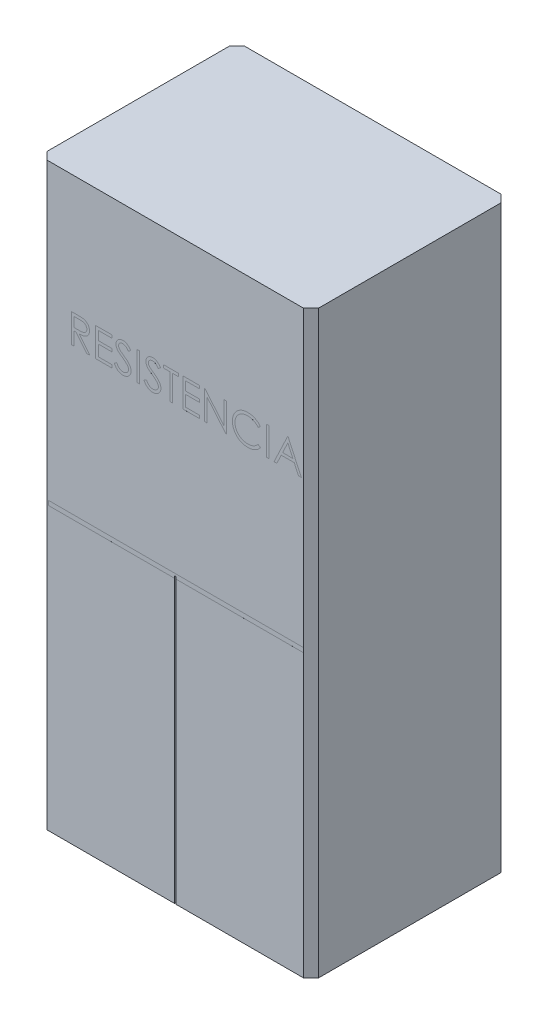
from build123d import *

# Parameters (mm, degrees)
SALIENTE_EXTRUIR1_DEPTH = 1150
CROQUIS2_W              = 6.269589385
CROQUIS2_H              = 1150
CORTAR_EXTRUIR1_DEPTH   = 51
SALIENTE_EXTRUIR2_DEPTH = 1200
CROQUIS4_W              = 1033.704287534
CROQUIS4_H              = 18.129714048
CORTAR_EXTRUIR2_DEPTH   = 0.01
CROQUIS6_W              = 10.447649573
CROQUIS6_H              = 116.416666667
CORTAR_EXTRUIR4_DEPTH   = 0.01


with BuildPart() as part:
    # Croquis1 → Saliente-Extruir1 (new body)
    with BuildSketch(Plane(origin=(0, 0, 0), x_dir=(1, 0, 0), z_dir=(0, 1, 0))):
        Polygon((-550, 370), (-520, 400), (520, 400), (550, 370), (550, -370), (520, -400), (-520, -400), (-550, -370), align=None)
    extrude(amount=SALIENTE_EXTRUIR1_DEPTH)

    # Croquis2 → Cortar-Extruir1 (cut)
    with BuildSketch(Plane.XY.offset(400)):
        with Locations((0.013061541, 575)):
            Rectangle(CROQUIS2_W, CROQUIS2_H)
    extrude(amount=-CORTAR_EXTRUIR1_DEPTH, mode=Mode.SUBTRACT)

    # Croquis3 → Saliente-Extruir2 (add)
    with BuildSketch(Plane(origin=(0, 1150, 0), x_dir=(1, 0, 0), z_dir=(0, 1, 0))):
        Polygon((-550, 370), (-520, 400), (520, 400), (550, 370), (550, -370), (520, -400), (-520, -400), (-550, -370), align=None)
    extrude(amount=SALIENTE_EXTRUIR2_DEPTH)

    # Croquis4 → Cortar-Extruir2 (cut)
    with BuildSketch(Plane.XY.offset(400)):
        with Locations((3.147856233, 1150)):
            Rectangle(CROQUIS4_W, CROQUIS4_H)
    extrude(amount=-CORTAR_EXTRUIR2_DEPTH, mode=Mode.SUBTRACT)

    # Croquis6 → Cortar-Extruir4 (cut)
    # profile 1 of 11: a face of its own
    with BuildSketch(Plane.XY.offset(400)):
        with BuildLine():
            Line((-420.727042954, 1868.160847318), (-397.429717233, 1868.160847318))
            add(Edge.make_bspline(
                [(-397.429717233, 1868.160847318), (-395.875018268, 1868.155672231), (-392.889824036, 1868.145735492), (-388.613232162, 1868.090329045), (-384.727340388, 1867.93152488), (-381.234180495, 1867.794865568), (-378.133816566, 1867.545669329), (-375.416741681, 1867.307492567), (-373.095469933, 1866.995706755), (-371.69029245, 1866.706147805), (-371.054066191, 1866.575043365)],
                knots=[0, 0, 0, 0, 1.410062039, 2.707475311, 3.878576406, 4.937260626, 5.877586885, 6.699081471, 7.410979367, 8, 8, 8, 8], degree=3))
            add(Edge.make_bspline(
                [(-371.054066191, 1866.575043365), (-370.202341098, 1866.364603098), (-368.517060519, 1865.948211826), (-366.09060237, 1865.068115103), (-363.778423547, 1864.049648065), (-361.590128677, 1862.853426225), (-359.53667867, 1861.470569863), (-357.59690057, 1859.9249516), (-355.761992181, 1858.225028589), (-354.106160339, 1856.327941123), (-352.544878072, 1854.337664837), (-351.228084948, 1852.185494639), (-350.092973229, 1849.934943354), (-349.18923008, 1847.563122816), (-348.46152701, 1845.093034833), (-347.948420906, 1842.502305094), (-347.640708784, 1839.80273647), (-347.609380874, 1837.96142698), (-347.593495945, 1837.027784417)],
                knots=[0, 0, 0, 0, 1.027469482, 2.033020251, 3.019912614, 3.986113645, 4.951240523, 5.91722682, 6.890402269, 7.87763091, 8.8651537, 9.85103654, 10.82876324, 11.815024772, 12.821070561, 13.842952187, 14.906261191, 16, 16, 16, 16], degree=3))
            add(Edge.make_bspline(
                [(-347.593495945, 1837.027784417), (-347.64235762, 1835.476612009), (-347.737699404, 1832.449872877), (-348.626627258, 1828.057276417), (-350.082717688, 1823.959765166), (-352.089185182, 1820.162498376), (-354.644347267, 1816.739494291), (-357.715245675, 1813.732935575), (-361.303593562, 1811.217008006), (-364.644063904, 1809.472327812), (-367.594867166, 1808.354963685), (-370.02409426, 1807.568773367), (-372.673969678, 1806.961345617), (-375.519104356, 1806.417176473), (-378.571338325, 1806.006335589), (-381.823356064, 1805.705428626), (-385.277476869, 1805.517364196), (-387.6503502, 1805.48935751), (-388.871040016, 1805.474949882)],
                knots=[0, 0, 0, 0, 1.260483769, 2.459530307, 3.627416485, 4.787058657, 5.939039949, 7.08810263, 8.267026773, 9.491475466, 10.141966685, 10.831826277, 11.566392101, 12.351337768, 13.187381173, 14.07005841, 15.007169909, 16, 16, 16, 16], degree=3))
            Line((-388.871040016, 1805.474949882), (-346.100974578, 1751.744180651))
            Line((-346.100974578, 1751.744180651), (-359.020612665, 1751.744180651))
            Line((-359.020612665, 1751.744180651), (-401.790678103, 1805.474949882))
            Line((-401.790678103, 1805.474949882), (-410.279393381, 1805.474949882))
            Line((-410.279393381, 1805.474949882), (-410.279393381, 1751.744180651))
            Line((-410.279393381, 1751.744180651), (-420.727042954, 1751.744180651))
            Line((-420.727042954, 1751.744180651), (-420.727042954, 1868.160847318))
        make_face()
        with BuildLine():
            Line((-410.279393381, 1856.220676377), (-410.279393381, 1817.415120822))
            Line((-410.279393381, 1817.415120822), (-388.964322601, 1817.251876297))
            add(Edge.make_bspline(
                [(-388.964322601, 1817.251876297), (-387.969125116, 1817.251436021), (-386.040148942, 1817.25058264), (-383.24945302, 1817.383423245), (-380.651029305, 1817.534542664), (-378.254816668, 1817.765691133), (-376.05974465, 1818.063587138), (-374.066910406, 1818.436219733), (-372.273060894, 1818.870356198), (-370.180935699, 1819.542300751), (-367.844734882, 1820.606881883), (-365.305805134, 1822.155739065), (-363.143703566, 1824.103859529), (-361.31703086, 1826.331524245), (-359.849201913, 1828.780806141), (-358.814355725, 1831.422345851), (-358.15768449, 1834.18945686), (-358.080232633, 1836.091309638), (-358.041145518, 1837.051105063)],
                knots=[0, 0, 0, 0, 1.146690395, 2.22261258, 3.21895312, 4.145990853, 4.996080663, 5.770904154, 6.481378293, 7.121626537, 8.300444488, 9.431385265, 10.535395872, 11.636531494, 12.74115979, 13.810798291, 14.895190096, 16, 16, 16, 16], degree=3))
            add(Edge.make_bspline(
                [(-358.041145518, 1837.051105063), (-358.081130355, 1837.987313718), (-358.160365712, 1839.842537657), (-358.807268799, 1842.558568768), (-359.901232269, 1845.121962324), (-361.375474326, 1847.522290551), (-363.171589075, 1849.701136098), (-365.277660131, 1851.565371165), (-367.636101979, 1853.103716455), (-369.840408267, 1854.086751445), (-371.810651002, 1854.689452278), (-373.521299456, 1855.113580274), (-375.454197893, 1855.454330824), (-377.6187316, 1855.727346563), (-380.005660129, 1855.962007447), (-382.6270525, 1856.120060656), (-385.465516357, 1856.213655136), (-387.43285595, 1856.218281497), (-388.451268381, 1856.220676377)],
                knots=[0, 0, 0, 0, 1.101028733, 2.181837193, 3.264309656, 4.369019818, 5.486613113, 6.575447106, 7.666700264, 8.788928104, 9.402425223, 10.0903467, 10.862060571, 11.710948788, 12.657782767, 13.684531032, 14.801375019, 16, 16, 16, 16], degree=3))
            Line((-388.451268381, 1856.220676377), (-410.279393381, 1856.220676377))
        make_face(mode=Mode.SUBTRACT)
    # profile 2 of 11: a face of its own
    with BuildSketch(Plane.XY.offset(400)):
        Polygon((-322.220632697, 1868.160847318), (-256.549692526, 1868.160847318), (-256.549692526, 1856.220676377), (-311.772983125, 1856.220676377), (-311.772983125, 1820.400163557), (-256.549692526, 1820.400163557), (-256.549692526, 1808.459992617), (-311.772983125, 1808.459992617), (-311.772983125, 1763.684351591), (-256.549692526, 1763.684351591), (-256.549692526, 1751.744180651), (-322.220632697, 1751.744180651), align=None)
    # profile 3 of 11: a face of its own
    with BuildSketch(Plane.XY.offset(400)):
        with BuildLine():
            Line((-247.594564321, 1774.201963103), (-237.753251554, 1780.102086634))
            add(Edge.make_bspline(
                [(-237.753251554, 1780.102086634), (-236.837942568, 1778.569897449), (-235.084245871, 1775.634282098), (-232.15881614, 1771.667532516), (-229.127561928, 1768.296034111), (-225.968035762, 1765.539400284), (-222.699523154, 1763.369098027), (-219.300686891, 1761.832323796), (-215.782980663, 1760.873849568), (-213.388994267, 1760.757430022), (-212.193823135, 1760.699308856)],
                knots=[0, 0, 0, 0, 1.272034388, 2.437168799, 3.508375237, 4.49857839, 5.41946034, 6.295179144, 7.148887113, 8, 8, 8, 8], degree=3))
            add(Edge.make_bspline(
                [(-212.193823135, 1760.699308856), (-211.173119704, 1760.727736892), (-209.149572753, 1760.784095539), (-206.170561957, 1761.325626027), (-203.277381534, 1762.157577076), (-200.529660893, 1763.349049489), (-197.965313905, 1764.790570073), (-195.716586444, 1766.531703644), (-193.772557393, 1768.481057677), (-192.182335178, 1770.655809309), (-190.962287337, 1772.994691609), (-190.024565443, 1775.395401229), (-189.504180493, 1777.895650988), (-189.425790384, 1779.579051383), (-189.386230988, 1780.428575683)],
                knots=[0, 0, 0, 0, 1.095163259, 2.171163733, 3.241058638, 4.321873601, 5.38011039, 6.391990106, 7.366004449, 8.327778327, 9.272591725, 10.192022065, 11.087607919, 12, 12, 12, 12], degree=3))
            add(Edge.make_bspline(
                [(-189.386230988, 1780.428575683), (-189.43526937, 1781.397855851), (-189.534957235, 1783.368260792), (-190.377530513, 1786.275339725), (-191.702992366, 1789.152247352), (-192.92578792, 1790.931801352), (-193.560626688, 1791.855692403)],
                knots=[0, 0, 0, 0, 0.938893495, 1.908633276, 2.914225137, 4, 4, 4, 4], degree=3))
            add(Edge.make_bspline(
                [(-193.560626688, 1791.855692403), (-194.081861164, 1792.522487941), (-195.176127748, 1793.922341764), (-197.057338346, 1796.006041621), (-199.264801719, 1798.155373318), (-201.722974724, 1800.452409093), (-204.521401512, 1802.790315092), (-207.572433361, 1805.280576623), (-210.953966955, 1807.828490983), (-213.325524021, 1809.537240366), (-214.549208419, 1810.418926912)],
                knots=[0, 0, 0, 0, 0.722233717, 1.516239348, 2.393582979, 3.351407094, 4.387010283, 5.505090956, 6.712668013, 8, 8, 8, 8], degree=3))
            add(Edge.make_bspline(
                [(-214.549208419, 1810.418926912), (-215.774044672, 1811.291339695), (-218.11583832, 1812.959326504), (-221.390758309, 1815.43481995), (-224.319284852, 1817.698088659), (-226.888401664, 1819.770438776), (-229.09697873, 1821.652151366), (-230.962419806, 1823.325156628), (-232.437204669, 1824.834700307), (-233.257296245, 1825.813975412), (-233.625497147, 1826.253645795)],
                knots=[0, 0, 0, 0, 1.452282411, 2.77665338, 3.964542531, 5.026858415, 5.96415736, 6.766646006, 7.446254459, 8, 8, 8, 8], degree=3))
            add(Edge.make_bspline(
                [(-233.625497147, 1826.253645795), (-234.140143473, 1826.938875521), (-235.152264542, 1828.286471739), (-236.48826239, 1830.392777127), (-237.623795972, 1832.548922408), (-238.513962115, 1834.760701522), (-239.26355968, 1836.997063323), (-239.767741327, 1839.2871869), (-240.083443268, 1841.620796186), (-240.115773391, 1843.191207147), (-240.131957484, 1843.977337035)],
                knots=[0, 0, 0, 0, 1.068054152, 2.10047183, 3.106115577, 4.101338837, 5.06977816, 6.043150881, 7.020423561, 8, 8, 8, 8], degree=3))
            add(Edge.make_bspline(
                [(-240.131957484, 1843.977337035), (-240.088543747, 1845.209017869), (-240.00264421, 1847.646053227), (-239.276187005, 1851.206102516), (-238.129552899, 1854.605017394), (-236.523172939, 1857.80914778), (-234.452374795, 1860.735063858), (-232.055988457, 1863.416421985), (-229.201734975, 1865.670534113), (-226.070039387, 1867.640039959), (-222.642188153, 1869.18159371), (-219.050205009, 1870.344462502), (-215.288380971, 1871.003356145), (-212.740414802, 1871.097911921), (-211.447562452, 1871.145890053)],
                knots=[0, 0, 0, 0, 1.005424448, 1.989358655, 2.955360095, 3.929531133, 4.905563448, 5.876582895, 6.856512386, 7.866279853, 8.892233794, 9.918561126, 10.94386622, 12, 12, 12, 12], degree=3))
            add(Edge.make_bspline(
                [(-211.447562452, 1871.145890053), (-210.075705116, 1871.098573277), (-207.347518725, 1871.004475312), (-203.334496007, 1870.186314568), (-199.470769321, 1868.832532699), (-196.362668346, 1867.296209956), (-193.9301334, 1865.7617912), (-192.075026077, 1864.364131807), (-190.195148011, 1862.755083552), (-188.275335568, 1860.930360533), (-186.348118872, 1858.873219789), (-184.384886425, 1856.597749969), (-182.381047293, 1854.117856909), (-181.091953565, 1852.347508634), (-180.431102783, 1851.439943872)],
                knots=[0, 0, 0, 0, 1.286793592, 2.559021753, 3.825965368, 5.121522368, 5.803751409, 6.523245864, 7.299691795, 8.125521123, 9.008227632, 9.944561021, 10.946284179, 12, 12, 12, 12], degree=3))
            Line((-180.431102783, 1851.439943872), (-189.875964562, 1844.280505437))
            add(Edge.make_bspline(
                [(-189.875964562, 1844.280505437), (-190.446270935, 1845.015217354), (-191.544547666, 1846.430100725), (-193.211949884, 1848.411556151), (-194.783529911, 1850.221551911), (-196.331884876, 1851.793680098), (-197.775239713, 1853.21403439), (-199.176132761, 1854.43008154), (-200.51440392, 1855.453736464), (-202.201344971, 1856.546175827), (-204.32071765, 1857.629067148), (-206.981155677, 1858.545401959), (-209.761394396, 1859.096054852), (-211.654982377, 1859.168861422), (-212.61359477, 1859.205719113)],
                knots=[0, 0, 0, 0, 1.181633172, 2.275549214, 3.290209073, 4.226197932, 5.078386478, 5.862611352, 6.581680152, 7.217281963, 8.414376989, 9.595101626, 10.782541182, 12, 12, 12, 12], degree=3))
            add(Edge.make_bspline(
                [(-212.61359477, 1859.205719113), (-213.816229575, 1859.165415664), (-216.135397504, 1859.087694261), (-219.42800131, 1858.23885094), (-222.39143496, 1856.90232573), (-224.937719089, 1855.029182292), (-227.057732349, 1852.809914987), (-228.591287727, 1850.256104022), (-229.514311058, 1847.436079821), (-229.626945169, 1845.468915681), (-229.684307911, 1844.467070608)],
                knots=[0, 0, 0, 0, 1.14458467, 2.207223713, 3.21896685, 4.227309161, 5.202851033, 6.127160689, 7.046193047, 8, 8, 8, 8], degree=3))
            add(Edge.make_bspline(
                [(-229.684307911, 1844.467070608), (-229.67123177, 1843.843360715), (-229.645058107, 1842.59492104), (-229.280015432, 1840.750501124), (-228.811044895, 1838.91074062), (-228.067886405, 1837.0839109), (-227.041912854, 1835.238062815), (-225.69463355, 1833.341411211), (-223.997833623, 1831.377238901), (-222.69805776, 1830.099736492), (-222.011815256, 1829.425253701)],
                knots=[0, 0, 0, 0, 0.858281714, 1.717966888, 2.583508476, 3.4729293, 4.427298488, 5.488583878, 6.674047936, 8, 8, 8, 8], degree=3))
            add(Edge.make_bspline(
                [(-222.011815256, 1829.425253701), (-221.756983417, 1829.1978412), (-221.151561298, 1828.657561151), (-220.044740625, 1827.773051245), (-218.583119455, 1826.681968557), (-216.804864812, 1825.331957102), (-214.677188518, 1823.765937993), (-212.199856615, 1822.00393475), (-209.400483725, 1819.988746983), (-207.414019046, 1818.579854501), (-206.363661544, 1817.834892457)],
                knots=[0, 0, 0, 0, 0.420754252, 0.999615792, 1.744751191, 2.668019286, 3.750313428, 4.999500688, 6.413464383, 8, 8, 8, 8], degree=3))
            add(Edge.make_bspline(
                [(-206.363661544, 1817.834892457), (-205.100177713, 1816.915488188), (-202.65361639, 1815.135189248), (-199.172505934, 1812.460410558), (-196.016157127, 1809.844435969), (-193.173488189, 1807.303971276), (-190.616415782, 1804.858286849), (-188.37330874, 1802.477959161), (-186.421311229, 1800.180041422), (-184.319850082, 1797.233948845), (-182.172534037, 1793.61568278), (-180.328443898, 1789.182594702), (-179.165662674, 1784.732274233), (-179.013605363, 1781.741136362), (-178.938581415, 1780.265331158)],
                knots=[0, 0, 0, 0, 1.163667725, 2.253281268, 3.268753668, 4.215851969, 5.092017293, 5.902905408, 6.650798638, 7.335211899, 8.59617414, 9.77448103, 10.901945474, 12, 12, 12, 12], degree=3))
            add(Edge.make_bspline(
                [(-178.938581415, 1780.265331158), (-178.960439081, 1779.221626967), (-179.003729951, 1777.154486614), (-179.501358441, 1774.119168938), (-180.230448256, 1771.171137392), (-181.329329585, 1768.346832056), (-182.670554635, 1765.59458364), (-184.372441498, 1762.986587524), (-186.34512806, 1760.465122314), (-188.608060668, 1758.097423804), (-191.084273181, 1755.923884857), (-193.701442739, 1753.99040155), (-196.463853008, 1752.378252793), (-199.356518351, 1751.062716452), (-202.380103217, 1750.033808738), (-205.533590694, 1749.28831402), (-208.82217896, 1748.830772873), (-211.057394978, 1748.783282807), (-212.193823135, 1748.759137916)],
                knots=[0, 0, 0, 0, 0.983748083, 1.948392443, 2.894712957, 3.844097841, 4.80183111, 5.778335162, 6.776009319, 7.81870978, 8.863265674, 9.881300176, 10.883814829, 11.87499822, 12.874611388, 13.892143829, 14.928324115, 16, 16, 16, 16], degree=3))
            add(Edge.make_bspline(
                [(-212.193823135, 1748.759137916), (-213.073112996, 1748.77614079), (-214.820618967, 1748.809932403), (-217.405384353, 1749.108666897), (-219.937932117, 1749.531329367), (-222.386483355, 1750.202357361), (-224.782584881, 1751.01650824), (-227.115815515, 1752.018966589), (-229.387306044, 1753.220293503), (-231.609786122, 1754.59384468), (-233.77760331, 1756.192336802), (-235.87042466, 1758.05412191), (-237.956916854, 1760.12785216), (-239.975495251, 1762.469841612), (-241.966990075, 1765.042253559), (-243.89213622, 1767.869155683), (-245.790782877, 1770.935150045), (-246.982073557, 1773.092686348), (-247.594564321, 1774.201963103)],
                knots=[0, 0, 0, 0, 0.915332311, 1.819136955, 2.706846663, 3.586547465, 4.459518054, 5.340707479, 6.227863349, 7.133153174, 8.059268498, 9.028702269, 10.047606654, 11.120612155, 12.245963614, 13.433783089, 14.680604001, 16, 16, 16, 16], degree=3))
        make_face()
    # profile 4 of 11: a face of its own
    with BuildSketch(Plane.XY.offset(400)):
        with Locations((-149.834414749, 1809.952513985)):
            Rectangle(CROQUIS6_W, CROQUIS6_H)
    # profile 5 of 11: a face of its own
    with BuildSketch(Plane.XY.offset(400)):
        with BuildLine():
            Line((-126.700333552, 1774.201963103), (-116.859020785, 1780.102086634))
            add(Edge.make_bspline(
                [(-116.859020785, 1780.102086634), (-115.943711798, 1778.569897449), (-114.190015102, 1775.634282098), (-111.26458537, 1771.667532516), (-108.233331159, 1768.296034111), (-105.073804993, 1765.539400284), (-101.805292385, 1763.369098027), (-98.406456121, 1761.832323796), (-94.888749894, 1760.873849568), (-92.494763498, 1760.757430022), (-91.299592366, 1760.699308856)],
                knots=[0, 0, 0, 0, 1.272034388, 2.437168799, 3.508375237, 4.49857839, 5.41946034, 6.295179144, 7.148887113, 8, 8, 8, 8], degree=3))
            add(Edge.make_bspline(
                [(-91.299592366, 1760.699308856), (-90.278888934, 1760.727736892), (-88.255341983, 1760.784095539), (-85.276331188, 1761.325626027), (-82.383150765, 1762.157577076), (-79.635430124, 1763.349049489), (-77.071083136, 1764.790570073), (-74.822355674, 1766.531703644), (-72.878326624, 1768.481057677), (-71.288104409, 1770.655809309), (-70.068056568, 1772.994691609), (-69.130334674, 1775.395401229), (-68.609949724, 1777.895650988), (-68.531559615, 1779.579051383), (-68.492000219, 1780.428575683)],
                knots=[0, 0, 0, 0, 1.095163259, 2.171163733, 3.241058638, 4.321873601, 5.38011039, 6.391990106, 7.366004449, 8.327778327, 9.272591725, 10.192022065, 11.087607919, 12, 12, 12, 12], degree=3))
            add(Edge.make_bspline(
                [(-68.492000219, 1780.428575683), (-68.541038601, 1781.397855851), (-68.640726466, 1783.368260792), (-69.483299743, 1786.275339725), (-70.808761597, 1789.152247352), (-72.03155715, 1790.931801352), (-72.666395919, 1791.855692403)],
                knots=[0, 0, 0, 0, 0.938893495, 1.908633276, 2.914225137, 4, 4, 4, 4], degree=3))
            add(Edge.make_bspline(
                [(-72.666395919, 1791.855692403), (-73.187630395, 1792.522487941), (-74.281896979, 1793.922341764), (-76.163107576, 1796.006041621), (-78.37057095, 1798.155373318), (-80.828743955, 1800.452409093), (-83.627170743, 1802.790315092), (-86.678202591, 1805.280576623), (-90.059736186, 1807.828490983), (-92.431293252, 1809.537240366), (-93.654977649, 1810.418926912)],
                knots=[0, 0, 0, 0, 0.722233717, 1.516239348, 2.393582979, 3.351407094, 4.387010283, 5.505090956, 6.712668013, 8, 8, 8, 8], degree=3))
            add(Edge.make_bspline(
                [(-93.654977649, 1810.418926912), (-94.879813903, 1811.291339695), (-97.22160755, 1812.959326504), (-100.496527539, 1815.43481995), (-103.425054083, 1817.698088659), (-105.994170894, 1819.770438776), (-108.202747961, 1821.652151366), (-110.068189037, 1823.325156628), (-111.5429739, 1824.834700307), (-112.363065476, 1825.813975412), (-112.731266378, 1826.253645795)],
                knots=[0, 0, 0, 0, 1.452282411, 2.77665338, 3.964542531, 5.026858415, 5.96415736, 6.766646006, 7.446254459, 8, 8, 8, 8], degree=3))
            add(Edge.make_bspline(
                [(-112.731266378, 1826.253645795), (-113.245912704, 1826.938875521), (-114.258033773, 1828.286471739), (-115.594031621, 1830.392777127), (-116.729565203, 1832.548922408), (-117.619731346, 1834.760701522), (-118.36932891, 1836.997063323), (-118.873510558, 1839.2871869), (-119.189212498, 1841.620796186), (-119.221542622, 1843.191207147), (-119.237726715, 1843.977337035)],
                knots=[0, 0, 0, 0, 1.068054152, 2.10047183, 3.106115577, 4.101338837, 5.06977816, 6.043150881, 7.020423561, 8, 8, 8, 8], degree=3))
            add(Edge.make_bspline(
                [(-119.237726715, 1843.977337035), (-119.194312977, 1845.209017869), (-119.108413441, 1847.646053227), (-118.381956236, 1851.206102516), (-117.23532213, 1854.605017394), (-115.628942169, 1857.80914778), (-113.558144026, 1860.735063858), (-111.161757688, 1863.416421985), (-108.307504205, 1865.670534113), (-105.175808617, 1867.640039959), (-101.747957384, 1869.18159371), (-98.15597424, 1870.344462502), (-94.394150201, 1871.003356145), (-91.846184033, 1871.097911921), (-90.553331682, 1871.145890053)],
                knots=[0, 0, 0, 0, 1.005424448, 1.989358655, 2.955360095, 3.929531133, 4.905563448, 5.876582895, 6.856512386, 7.866279853, 8.892233794, 9.918561126, 10.94386622, 12, 12, 12, 12], degree=3))
            add(Edge.make_bspline(
                [(-90.553331682, 1871.145890053), (-89.181474346, 1871.098573277), (-86.453287956, 1871.004475312), (-82.440265238, 1870.186314568), (-78.576538552, 1868.832532699), (-75.468437577, 1867.296209956), (-73.03590263, 1865.7617912), (-71.180795307, 1864.364131807), (-69.300917242, 1862.755083552), (-67.381104799, 1860.930360533), (-65.453888103, 1858.873219789), (-63.490655656, 1856.597749969), (-61.486816524, 1854.117856909), (-60.197722796, 1852.347508634), (-59.536872014, 1851.439943872)],
                knots=[0, 0, 0, 0, 1.286793592, 2.559021753, 3.825965368, 5.121522368, 5.803751409, 6.523245864, 7.299691795, 8.125521123, 9.008227632, 9.944561021, 10.946284179, 12, 12, 12, 12], degree=3))
            Line((-59.536872014, 1851.439943872), (-68.981733793, 1844.280505437))
            add(Edge.make_bspline(
                [(-68.981733793, 1844.280505437), (-69.552040165, 1845.015217354), (-70.650316897, 1846.430100725), (-72.317719115, 1848.411556151), (-73.889299142, 1850.221551911), (-75.437654106, 1851.793680098), (-76.881008943, 1853.21403439), (-78.281901992, 1854.43008154), (-79.620173151, 1855.453736464), (-81.307114202, 1856.546175827), (-83.426486881, 1857.629067148), (-86.086924908, 1858.545401959), (-88.867163627, 1859.096054852), (-90.760751608, 1859.168861422), (-91.719364001, 1859.205719113)],
                knots=[0, 0, 0, 0, 1.181633172, 2.275549214, 3.290209073, 4.226197932, 5.078386478, 5.862611352, 6.581680152, 7.217281963, 8.414376989, 9.595101626, 10.782541182, 12, 12, 12, 12], degree=3))
            add(Edge.make_bspline(
                [(-91.719364001, 1859.205719113), (-92.921998806, 1859.165415664), (-95.241166735, 1859.087694261), (-98.533770541, 1858.23885094), (-101.497204191, 1856.90232573), (-104.043488319, 1855.029182292), (-106.16350158, 1852.809914987), (-107.697056958, 1850.256104022), (-108.620080288, 1847.436079821), (-108.7327144, 1845.468915681), (-108.790077142, 1844.467070608)],
                knots=[0, 0, 0, 0, 1.14458467, 2.207223713, 3.21896685, 4.227309161, 5.202851033, 6.127160689, 7.046193047, 8, 8, 8, 8], degree=3))
            add(Edge.make_bspline(
                [(-108.790077142, 1844.467070608), (-108.777001001, 1843.843360715), (-108.750827338, 1842.59492104), (-108.385784662, 1840.750501124), (-107.916814125, 1838.91074062), (-107.173655636, 1837.0839109), (-106.147682085, 1835.238062815), (-104.800402781, 1833.341411211), (-103.103602854, 1831.377238901), (-101.803826991, 1830.099736492), (-101.117584487, 1829.425253701)],
                knots=[0, 0, 0, 0, 0.858281714, 1.717966888, 2.583508476, 3.4729293, 4.427298488, 5.488583878, 6.674047936, 8, 8, 8, 8], degree=3))
            add(Edge.make_bspline(
                [(-101.117584487, 1829.425253701), (-100.862752648, 1829.1978412), (-100.257330529, 1828.657561151), (-99.150509856, 1827.773051245), (-97.688888686, 1826.681968557), (-95.910634042, 1825.331957102), (-93.782957749, 1823.765937993), (-91.305625846, 1822.00393475), (-88.506252956, 1819.988746983), (-86.519788277, 1818.579854501), (-85.469430774, 1817.834892457)],
                knots=[0, 0, 0, 0, 0.420754252, 0.999615792, 1.744751191, 2.668019286, 3.750313428, 4.999500688, 6.413464383, 8, 8, 8, 8], degree=3))
            add(Edge.make_bspline(
                [(-85.469430774, 1817.834892457), (-84.205946944, 1816.915488188), (-81.759385621, 1815.135189248), (-78.278275165, 1812.460410558), (-75.121926358, 1809.844435969), (-72.27925742, 1807.303971276), (-69.722185013, 1804.858286849), (-67.479077971, 1802.477959161), (-65.52708046, 1800.180041422), (-63.425619313, 1797.233948845), (-61.278303268, 1793.61568278), (-59.434213128, 1789.182594702), (-58.271431905, 1784.732274233), (-58.119374594, 1781.741136362), (-58.044350646, 1780.265331158)],
                knots=[0, 0, 0, 0, 1.163667725, 2.253281268, 3.268753668, 4.215851969, 5.092017293, 5.902905408, 6.650798638, 7.335211899, 8.59617414, 9.77448103, 10.901945474, 12, 12, 12, 12], degree=3))
            add(Edge.make_bspline(
                [(-58.044350646, 1780.265331158), (-58.066208312, 1779.221626967), (-58.109499182, 1777.154486614), (-58.607127671, 1774.119168938), (-59.336217486, 1771.171137392), (-60.435098816, 1768.346832056), (-61.776323865, 1765.59458364), (-63.478210729, 1762.986587524), (-65.45089729, 1760.465122314), (-67.713829899, 1758.097423804), (-70.190042412, 1755.923884857), (-72.80721197, 1753.99040155), (-75.569622239, 1752.378252793), (-78.462287582, 1751.062716452), (-81.485872448, 1750.033808738), (-84.639359925, 1749.28831402), (-87.927948191, 1748.830772873), (-90.163164209, 1748.783282807), (-91.299592366, 1748.759137916)],
                knots=[0, 0, 0, 0, 0.983748083, 1.948392443, 2.894712957, 3.844097841, 4.80183111, 5.778335162, 6.776009319, 7.81870978, 8.863265674, 9.881300176, 10.883814829, 11.87499822, 12.874611388, 13.892143829, 14.928324115, 16, 16, 16, 16], degree=3))
            add(Edge.make_bspline(
                [(-91.299592366, 1748.759137916), (-92.178882227, 1748.77614079), (-93.926388198, 1748.809932403), (-96.511153583, 1749.108666897), (-99.043701348, 1749.531329367), (-101.492252586, 1750.202357361), (-103.888354111, 1751.01650824), (-106.221584745, 1752.018966589), (-108.493075275, 1753.220293503), (-110.715555353, 1754.59384468), (-112.883372541, 1756.192336802), (-114.976193891, 1758.05412191), (-117.062686085, 1760.12785216), (-119.081264482, 1762.469841612), (-121.072759305, 1765.042253559), (-122.997905451, 1767.869155683), (-124.896552108, 1770.935150045), (-126.087842788, 1773.092686348), (-126.700333552, 1774.201963103)],
                knots=[0, 0, 0, 0, 0.915332311, 1.819136955, 2.706846663, 3.586547465, 4.459518054, 5.340707479, 6.227863349, 7.133153174, 8.059268498, 9.028702269, 10.047606654, 11.120612155, 12.245963614, 13.433783089, 14.680604001, 16, 16, 16, 16], degree=3))
        make_face()
    # profile 6 of 11: a face of its own
    with BuildSketch(Plane.XY.offset(400)):
        Polygon((-47.596701074, 1856.220676377), (-47.596701074, 1868.160847318), (13.596674995, 1868.160847318), (13.596674995, 1856.220676377), (-11.776188253, 1856.220676377), (-11.776188253, 1751.744180651), (-22.223837826, 1751.744180651), (-22.223837826, 1856.220676377), align=None)
    # profile 7 of 11: a face of its own
    with BuildSketch(Plane.XY.offset(400)):
        Polygon((31.506931405, 1868.160847318), (97.177871576, 1868.160847318), (97.177871576, 1856.220676377), (41.954580978, 1856.220676377), (41.954580978, 1820.400163557), (97.177871576, 1820.400163557), (97.177871576, 1808.459992617), (41.954580978, 1808.459992617), (41.954580978, 1763.684351591), (97.177871576, 1763.684351591), (97.177871576, 1751.744180651), (31.506931405, 1751.744180651), align=None)
    # profile 8 of 11: a face of its own
    with BuildSketch(Plane.XY.offset(400)):
        Polygon((118.073170721, 1751.744180651), (118.073170721, 1868.160847318), (120.26531148, 1868.160847318), (197.1768032, 1776.53402774), (197.1768032, 1868.160847318), (207.624452773, 1868.160847318), (207.624452773, 1751.744180651), (205.245746843, 1751.744180651), (128.520820294, 1843.161114412), (128.520820294, 1751.744180651), align=None)
    # profile 9 of 11: a face of its own
    with BuildSketch(Plane.XY.offset(400)):
        with BuildLine():
            Line((344.936418585, 1846.799135245), (335.794725209, 1839.802941335))
            add(Edge.make_bspline(
                [(335.794725209, 1839.802941335), (335.142596017, 1840.580137998), (333.84712975, 1842.124053028), (331.762965323, 1844.292048829), (329.590908297, 1846.323195739), (327.331788955, 1848.227169687), (324.944943957, 1849.937389252), (322.488193106, 1851.542978081), (319.920439079, 1852.98214546), (316.369673048, 1854.727164307), (311.724719618, 1856.548125702), (305.877448423, 1858.074954609), (299.773519743, 1859.046906572), (295.609209107, 1859.152175227), (293.491072698, 1859.205719113)],
                knots=[0, 0, 0, 0, 0.757959112, 1.505699292, 2.245454638, 2.979532153, 3.711538275, 4.438200793, 5.171680507, 5.909471876, 7.393775596, 8.890124382, 10.418191784, 12, 12, 12, 12], degree=3))
            add(Edge.make_bspline(
                [(293.491072698, 1859.205719113), (292.324135336, 1859.19228255), (290.001090893, 1859.165534129), (286.553545239, 1858.812654417), (283.170375419, 1858.316679168), (279.853782126, 1857.580748774), (276.607987053, 1856.650326183), (273.411770727, 1855.538533248), (270.311408634, 1854.162992503), (267.26401152, 1852.642648714), (264.344307763, 1850.925421564), (261.581738674, 1849.052332217), (258.986379837, 1847.04434108), (256.55617819, 1844.893922137), (254.288649337, 1842.610759785), (252.200223785, 1840.170522042), (250.298128115, 1837.581010461), (248.544659448, 1834.876371643), (246.974274007, 1832.064483669), (245.659434924, 1829.134939064), (244.495097883, 1826.137904971), (243.573768312, 1823.039519931), (242.844517121, 1819.861585552), (242.341342226, 1816.595572915), (241.992475696, 1813.248305049), (241.965860288, 1810.979533388), (241.952444226, 1809.835910752)],
                knots=[0, 0, 0, 0, 1.054917814, 2.100044995, 3.131103042, 4.146048494, 5.169673617, 6.183595914, 7.203665975, 8.234915748, 9.262203917, 10.264457458, 11.251630812, 12.227803204, 13.197192746, 14.159520551, 15.12972552, 16.100847026, 17.073214652, 18.039054194, 19.002613845, 19.979014051, 20.95965708, 21.949030935, 22.966165397, 24, 24, 24, 24], degree=3))
            add(Edge.make_bspline(
                [(241.952444226, 1809.835910752), (241.99441473, 1808.115228516), (242.076818248, 1804.736897182), (242.810187836, 1799.788503303), (243.924630992, 1795.047994225), (245.594896729, 1790.545002803), (247.654442292, 1786.22400337), (250.25687406, 1782.158106269), (253.270952696, 1778.285869588), (256.739318505, 1774.698807731), (260.544673861, 1771.422053582), (264.627503206, 1768.536564002), (268.977637731, 1766.131233268), (273.54704612, 1764.129666666), (278.370890909, 1762.591079796), (283.440497552, 1761.507935022), (288.74483987, 1760.801379636), (292.369369671, 1760.733735297), (294.214012735, 1760.699308856)],
                knots=[0, 0, 0, 0, 1.029171465, 2.020641659, 2.987623507, 3.938342917, 4.889210282, 5.84687017, 6.821220943, 7.821438502, 8.827599549, 9.822697543, 10.807740252, 11.797342354, 12.80366471, 13.83203677, 14.896651826, 16, 16, 16, 16], degree=3))
            add(Edge.make_bspline(
                [(294.214012735, 1760.699308856), (296.246404557, 1760.755480887), (300.246637852, 1760.866040882), (306.112974347, 1761.802671145), (311.728773504, 1763.321340459), (317.094337394, 1765.446707066), (322.194539793, 1768.209616761), (327.037362042, 1771.559019969), (331.626891899, 1775.526777133), (334.386674786, 1778.55637547), (335.794725209, 1780.102086634)],
                knots=[0, 0, 0, 0, 1.028121516, 2.023589091, 2.998037872, 3.967518031, 4.937445131, 5.927275754, 6.942489185, 8, 8, 8, 8], degree=3))
            Line((335.794725209, 1780.102086634), (344.936418585, 1773.175854663))
            add(Edge.make_bspline(
                [(344.936418585, 1773.175854663), (344.20072812, 1772.226611393), (342.732871107, 1770.332671675), (340.356041352, 1767.662681711), (337.852175055, 1765.151273673), (335.202674415, 1762.818695414), (332.438018347, 1760.61827188), (329.508565482, 1758.612518111), (326.452826472, 1756.773437984), (323.281154876, 1755.089490042), (319.996920541, 1753.59545685), (316.60405874, 1752.316411287), (313.117194122, 1751.214614367), (309.536167283, 1750.308163043), (305.853550323, 1749.600646277), (302.082632411, 1749.127672806), (298.215274895, 1748.803638176), (295.606163816, 1748.774104405), (294.283974674, 1748.759137916)],
                knots=[0, 0, 0, 0, 0.986787822, 1.968848986, 2.935600012, 3.899624008, 4.868462664, 5.837806735, 6.815139263, 7.798259679, 8.787526145, 9.778297419, 10.776456485, 11.791383307, 12.812564526, 13.85620153, 14.913611965, 16, 16, 16, 16], degree=3))
            add(Edge.make_bspline(
                [(294.283974674, 1748.759137916), (293.031874606, 1748.767852287), (290.556001771, 1748.785083878), (286.900559961, 1749.064223351), (283.341882714, 1749.44506341), (279.890140992, 1750.018503007), (276.526498441, 1750.695194508), (273.281447571, 1751.602288449), (270.123056408, 1752.618411919), (267.064014218, 1753.812680168), (264.101718965, 1755.160325573), (261.245725049, 1756.683440044), (258.497346, 1758.3692154), (255.82956093, 1760.18049277), (253.281779397, 1762.175452073), (250.831922852, 1764.326387511), (248.466253821, 1766.62604944), (247.002640703, 1768.284316824), (246.266763804, 1769.118062195)],
                knots=[0, 0, 0, 0, 1.114604814, 2.203992996, 3.262667896, 4.300477797, 5.318619304, 6.316056647, 7.298880507, 8.271930387, 9.238335007, 10.195173496, 11.151986948, 12.108099108, 13.064862484, 14.031167946, 15.010108607, 16, 16, 16, 16], degree=3))
            add(Edge.make_bspline(
                [(246.266763804, 1769.118062195), (245.088106804, 1770.566325074), (242.745022587, 1773.445366132), (239.747270684, 1778.11154508), (237.18119605, 1782.983356694), (235.106454114, 1788.086395754), (233.484512728, 1793.409211467), (232.360885834, 1798.95448703), (231.630733657, 1804.717043584), (231.54723667, 1808.636519626), (231.504794653, 1810.628812729)],
                knots=[0, 0, 0, 0, 0.994628077, 1.977248131, 2.950237994, 3.925870899, 4.908910175, 5.911660606, 6.938484602, 8, 8, 8, 8], degree=3))
            add(Edge.make_bspline(
                [(231.504794653, 1810.628812729), (231.556523353, 1812.722831029), (231.658296341, 1816.842681305), (232.522966014, 1822.888829228), (233.91393883, 1828.681436471), (235.889592482, 1834.209689594), (238.394391905, 1839.50266582), (241.488634275, 1844.51993161), (245.136372315, 1849.293573732), (249.308997364, 1853.751159626), (253.884748969, 1857.827051903), (258.784853326, 1861.412891584), (263.999719515, 1864.397067057), (269.471896629, 1866.891582269), (275.242360847, 1868.808946912), (281.298800529, 1870.151170765), (287.629835385, 1870.986613894), (291.949307019, 1871.092227357), (294.144050796, 1871.145890053)],
                knots=[0, 0, 0, 0, 1.032925535, 2.032216505, 3.007276963, 3.968222605, 4.92396291, 5.891752235, 6.871517503, 7.883894988, 8.900124299, 9.891468569, 10.874487609, 11.85992873, 12.854644235, 13.869047385, 14.917252991, 16, 16, 16, 16], degree=3))
            add(Edge.make_bspline(
                [(294.144050796, 1871.145890053), (295.481660732, 1871.129853218), (298.129324892, 1871.098109919), (302.046002402, 1870.788569906), (305.859224563, 1870.272557814), (309.571618417, 1869.57019711), (313.201244485, 1868.69849168), (316.720362021, 1867.562920329), (320.149620724, 1866.264490942), (323.467392884, 1864.769086729), (326.65776004, 1863.090466783), (329.719728539, 1861.24723759), (332.62897634, 1859.24168425), (335.405974465, 1857.090863868), (338.004268438, 1854.749273693), (340.497629998, 1852.281320323), (342.801385384, 1849.615916695), (344.223438084, 1847.739781155), (344.936418585, 1846.799135245)],
                knots=[0, 0, 0, 0, 1.096760587, 2.17092713, 3.219439832, 4.250915756, 5.268269357, 6.278326846, 7.281116186, 8.274029601, 9.260640565, 10.235837813, 11.203064059, 12.156899882, 13.114053108, 14.069676657, 15.032185724, 16, 16, 16, 16], degree=3))
        make_face()
    # profile 10 of 11: a face of its own
    with BuildSketch(Plane.XY.offset(400)):
        with Locations((374.040585252, 1809.952513985)):
            Rectangle(CROQUIS6_W, CROQUIS6_H)
    # profile 11 of 11: a face of its own
    with BuildSketch(Plane.XY.offset(400)):
        Polygon((456.875521149, 1868.160847318), (510.606290379, 1751.744180651), (499.249135599, 1751.744180651), (482.038498579, 1789.057214839), (429.26387585, 1789.057214839), (411.563505257, 1751.744180651), (400.159709183, 1751.744180651), (455.382999781, 1868.160847318), align=None)
        Polygon((456.012657233, 1845.469858402), (434.930792917, 1800.997385779), (476.534826037, 1800.997385779), align=None, mode=Mode.SUBTRACT)
    extrude(amount=-CORTAR_EXTRUIR4_DEPTH, mode=Mode.SUBTRACT)


solid = part.part
